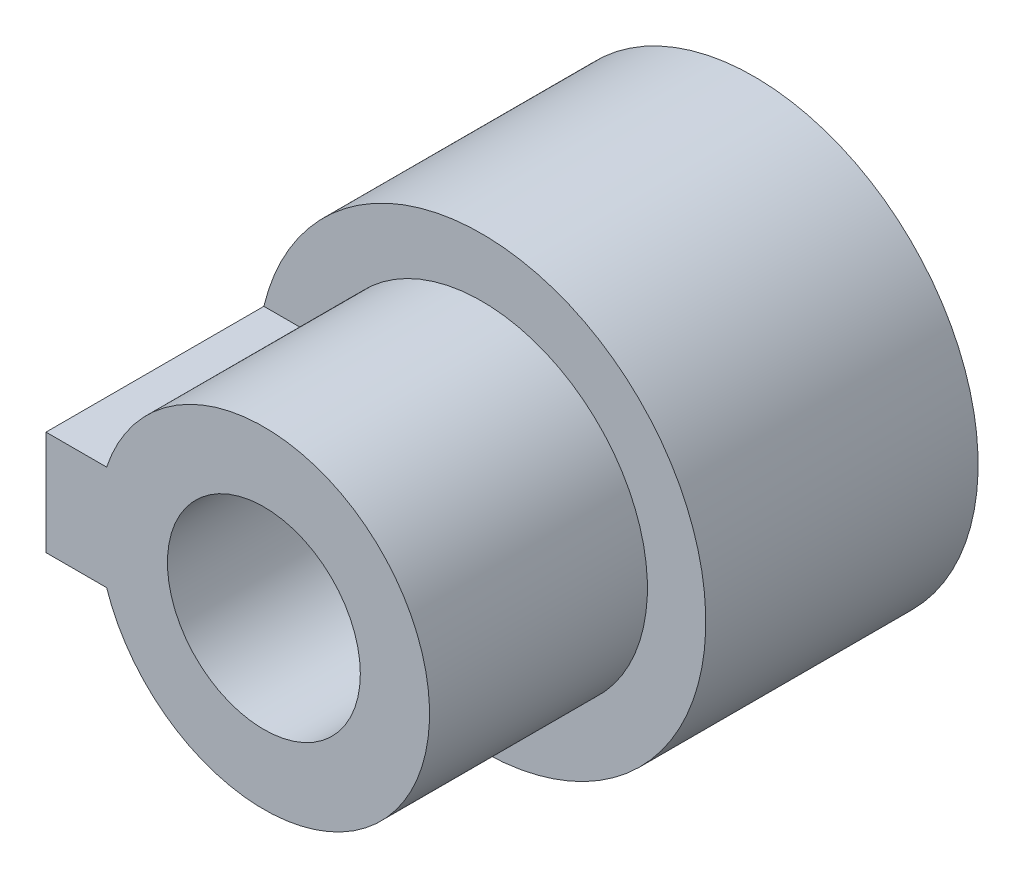
from build123d import *

# Parameters (mm, degrees)
SKETCH1_R           = 4.25
BOSS_EXTRUDE1_DEPTH = 10
SKETCH2_R           = 9.871676656
BOSS_EXTRUDE2_DEPTH = 7
SKETCH3_R           = 9.871676656
SKETCH3_R_2         = 7.3
BOSS_EXTRUDE3_DEPTH = 5
SKETCH4_R           = 4.25
BOSS_EXTRUDE4_DEPTH = 5
CUT_EXTRUDE2_START  = -0.4
CUT_EXTRUDE2_DEPTH  = 0.4


with BuildPart() as part:
    # Sketch1 → Boss-Extrude1 (new body)
    with BuildSketch(Plane.XY):
        with BuildLine():
            Line((-9.6, -2.3), (-6.92820323, -2.3))
            ThreePointArc((-6.92820323, -2.3), (7.3, 0), (-6.92820323, 2.3))
            Line((-6.92820323, 2.3), (-9.6, 2.3))
            Line((-9.6, 2.3), (-9.6, -2.3))
        make_face()
        Circle(SKETCH1_R, mode=Mode.SUBTRACT)
    extrude(amount=BOSS_EXTRUDE1_DEPTH)

    # Sketch2 → Boss-Extrude2 (add)
    with BuildSketch(Plane(origin=(0, 0, 0), x_dir=(-1, 0, 0), z_dir=(0, 0, -1))):
        Circle(SKETCH2_R)
        Polygon((0, -7.505553499), (6.5, -3.75277675), (6.5, 3.75277675), (0, 7.505553499), (-6.5, 3.75277675), (-6.5, -3.75277675), align=None, mode=Mode.SUBTRACT)
    extrude(amount=BOSS_EXTRUDE2_DEPTH)

    # Sketch3 → Boss-Extrude3 (add)
    with BuildSketch(Plane.XY):
        Circle(SKETCH3_R)
        Circle(SKETCH3_R_2, mode=Mode.SUBTRACT)
    extrude(amount=BOSS_EXTRUDE3_DEPTH)

    # Sketch4 → Boss-Extrude4 (add)
    with BuildSketch(Plane.XY.offset(10)):
        with BuildLine():
            Line((-9.6, -2.3), (-6.92820323, -2.3))
            ThreePointArc((-6.92820323, -2.3), (7.3, 0), (-6.92820323, 2.3))
            Line((-6.92820323, 2.3), (-9.6, 2.3))
            Line((-9.6, 2.3), (-9.6, -2.3))
        make_face()
        Circle(SKETCH4_R, mode=Mode.SUBTRACT)
    extrude(amount=BOSS_EXTRUDE4_DEPTH)

    # Sketch6 → Cut-Extrude2 (cut)
    with BuildSketch(Plane.XY.offset(15).offset(CUT_EXTRUDE2_START)):
        with BuildLine():
            Line((-9.6, 2.3), (-9.6, -2.3))
            Line((-9.6, -2.3), (-6.92820323, -2.3))
            ThreePointArc((-6.92820323, -2.3), (7.3, 0), (-6.92820323, 2.3))
            Line((-6.92820323, 2.3), (-9.6, 2.3))
        make_face()
    extrude(amount=CUT_EXTRUDE2_DEPTH, mode=Mode.SUBTRACT)


solid = part.part
